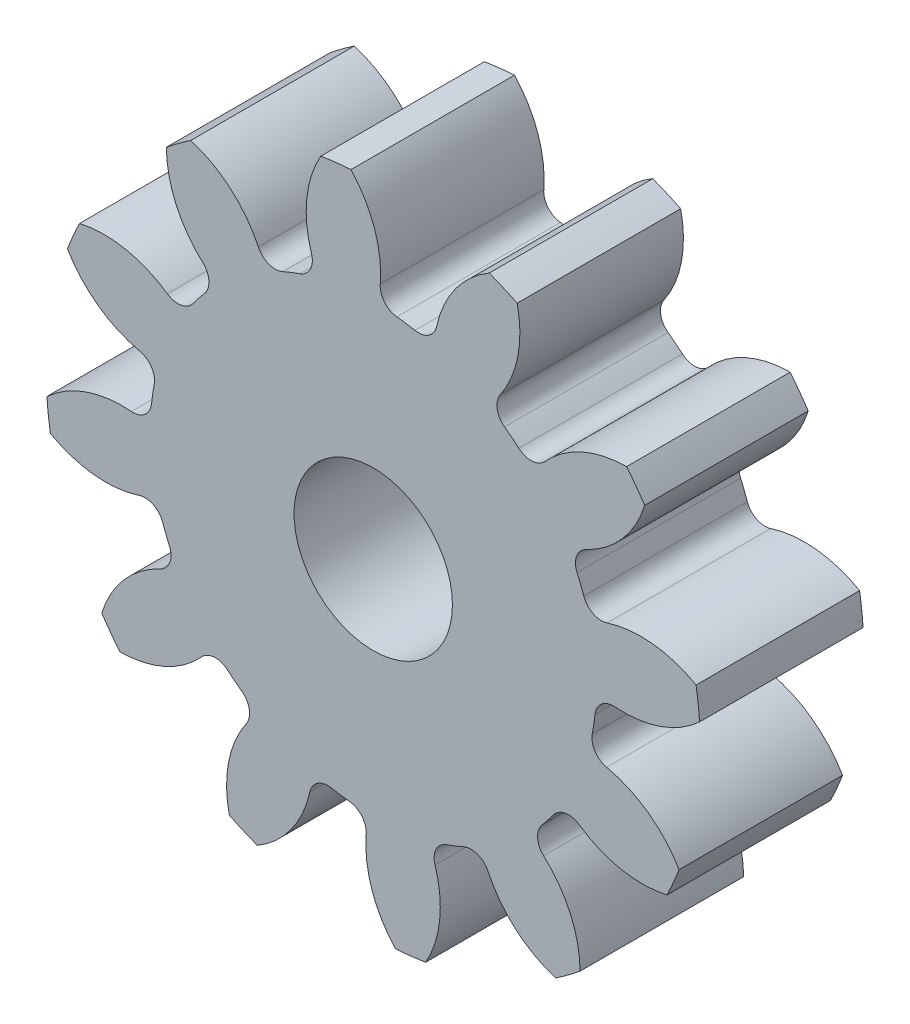
from build123d import *

# Parameters (mm, degrees)
SKETCH3_R         = 12.7
GEARBODY_DEPTH    = 6.35
TOOTHCUT_DEPTH    = 20.05
CIRPATTERN1_COUNT = 12
BOREDIA_R         = 3.075
BORE_DEPTH        = 12700


with BuildPart() as part:
    # Sketch3 → gearBody (new body)
    with BuildSketch(Plane.XY):
        Circle(SKETCH3_R)
    extrude(amount=GEARBODY_DEPTH)

    # Sketch2 → toothCut (cut, through all)
    with BuildSketch(Plane.XY):
        with BuildLine():
            ThreePointArc((8.504981128, -1.619352377), (8.564111751, -1.270037802), (8.608901587, -0.918596522))
            ThreePointArc((8.608901587, -0.918596522), (8.867488023, -0.436790342), (9.388953743, -0.272237485))
            ThreePointArc((9.388953743, -0.272237485), (11.599176183, 0.135890641), (13.30511426, 1.599252209))
            ThreePointArc((13.30511426, 1.599252209), (13.255912686, -1.96582094), (12.268366453, -5.391739765))
            ThreePointArc((12.268366453, -5.391739765), (11.060534793, -3.49627294), (9.063879737, -2.464274691))
            ThreePointArc((9.063879737, -2.464274691), (8.61261217, -2.155467755), (8.504981128, -1.619352377))
        make_face()
    toothcut = extrude(amount=TOOTHCUT_DEPTH, mode=Mode.SUBTRACT)

    # CirPattern1: toothCut ×12 about axis
    cirpattern1_axis = Axis((0, 0, 6.35), (0, 0, -1))
    for i in range(1, CIRPATTERN1_COUNT):
        add(toothcut.rotate(cirpattern1_axis, i * 360 / CIRPATTERN1_COUNT), mode=Mode.SUBTRACT)

    # boreDia → bore (cut, symmetric)
    with BuildSketch(Plane.XY):
        Circle(BOREDIA_R)
    extrude(amount=BORE_DEPTH, both=True, mode=Mode.SUBTRACT)


solid = part.part
